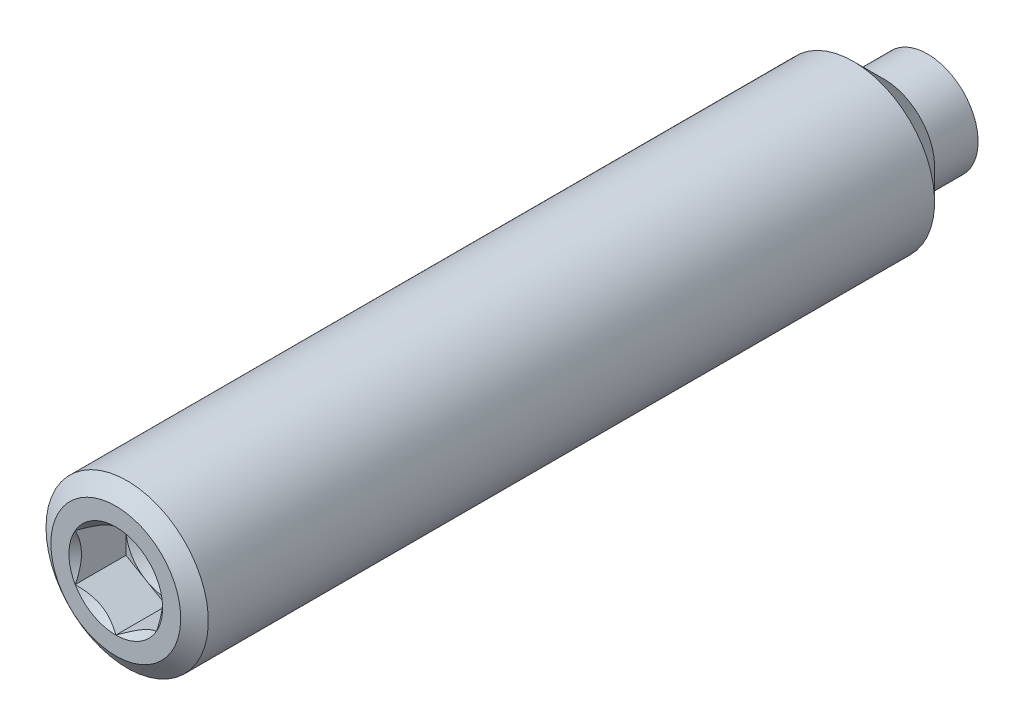
from build123d import *

# Parameters (mm, degrees)
CUT_EXTRUDE10_DEPTH = 1.984375


with BuildPart() as part:
    # Sketch22 → Revolve1 (revolve)
    with BuildSketch(Plane(origin=(0, 0, 0), x_dir=(0, 0, -1), z_dir=(1, 0, 0))):
        Polygon((-15.875, 0), (-15.875, 2.54), (-15.430368213, 3.175), (12.9794, 3.175), (14.1732, 1.9812), (15.875, 1.9812), (15.875, 0), align=None)
    revolve(axis=Axis((0, 0, -15.875), (0, 0, 1)))

    # Sketch23 → Cut-Extrude10 (cut)
    with BuildSketch(Plane.XY.offset(15.875)):
        Polygon((0, 1.833087105), (-1.5875, 0.916543552), (-1.5875, -0.916543552), (0, -1.833087105), (1.5875, -0.916543552), (1.5875, 0.916543552), align=None)
    extrude(amount=-CUT_EXTRUDE10_DEPTH, mode=Mode.SUBTRACT)

    # Cut-Extrude11 cone 1 section (through the dimple's axis) → Cut-Extrude11 (revolve, cut)
    with BuildSketch(Plane(origin=(0, 0, 15.875), x_dir=(0, -1, 0), z_dir=(1, 0, 0))):
        Polygon((0, 0), (1.833087105, 0), (0, 1.833087105), align=None)
    revolve(axis=Axis((0, 0, 15.875), (0, 0, -1)), mode=Mode.SUBTRACT)

    # Cut-Extrude12 cone 1 section (through the dimple's axis) → Cut-Extrude12 (revolve, cut)
    with BuildSketch(Plane(origin=(0, 0, 13.890625), x_dir=(0, -1, 0), z_dir=(1, 0, 0))):
        Polygon((0, 0), (1.5875, 0), (0, 0.916543552), align=None)
    revolve(axis=Axis((0, 0, 13.890625), (0, 0, -1)), mode=Mode.SUBTRACT)


solid = part.part
